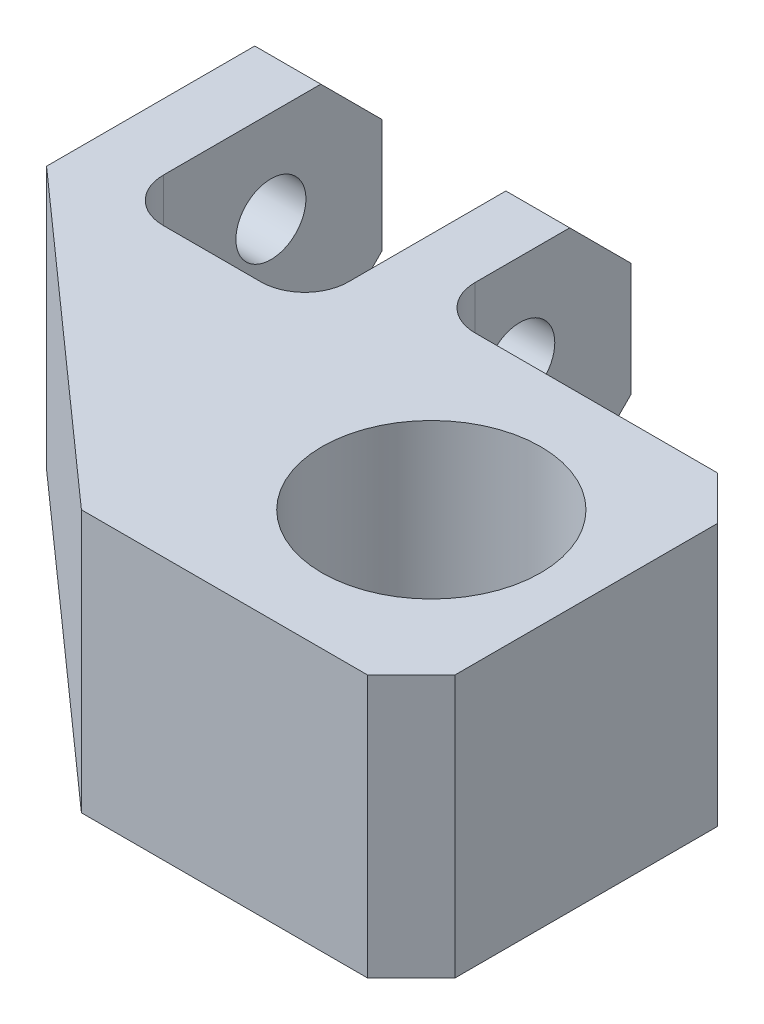
from build123d import *

# Parameters (mm, degrees)
SKETCH_1_W          = 37.703662968
SKETCH_1_H          = 40
SKETCH_1_R          = 12.5
EXTRUDE_1_DEPTH     = 30
EXTRUDE_3_DEPTH     = 30
SKETCH_9_W          = 21.151556031
SKETCH_9_H          = 33.5604842
CUT_EXTRUDE_5_DEPTH = 30
FILLET_4_R          = 5
CHAMFER_4_SIZE      = 7
FILLET_5_R          = 5
SKETCH_10_R         = 4.000000001
CUT_EXTRUDE_6_DEPTH = 91.362494631
CHAMFER_6_SIZE      = 10
CHAMFER_7_SIZE      = 5


with BuildPart() as part:
    # Эскиз1 → Вытянуть1 (new body)
    with BuildSketch(Plane(origin=(0, 0, 0), x_dir=(1, 0, 0), z_dir=(0, 1, 0))):
        with Locations((-1.148168516, 0)):
            Rectangle(SKETCH_1_W, SKETCH_1_H)
        with Locations(Location((0, 0, 0), (0, 0, 270))):
            Circle(SKETCH_1_R, mode=Mode.SUBTRACT)
    extrude(amount=EXTRUDE_1_DEPTH)

    # Эскиз8 → Вытянуть3 (add)
    with BuildSketch(Plane.XZ):
        Polygon((-20, 20), (-56, -12.013671604), (-56, -42.815306854), (-20, -42.815306854), align=None)
    extrude(amount=-EXTRUDE_3_DEPTH)

    # Эскиз9 → Вырез-Вытянуть5 (cut)
    with BuildSketch(Plane(origin=(0, 0, -42.815306854), x_dir=(-1, 0, 0), z_dir=(0, 0, -1))):
        with Locations((37.872859834, 13.650165161)):
            Rectangle(SKETCH_9_W, SKETCH_9_H)
    extrude(amount=-CUT_EXTRUDE_5_DEPTH, mode=Mode.SUBTRACT)

    # Скругление4
    fillet_4_edges = [part.edges().sort_by_distance(p)[0] for p in [
        (-27.297081818, 15, -12.815306854),
        (-48.448637849, 15, -12.815306854),
    ]]
    fillet(fillet_4_edges, radius=FILLET_4_R)

    # Фаска4
    chamfer_4_edges = [part.edges().sort_by_distance(p)[0] for p in [
        (-52.224318925, 30, -42.815306854),
        (-23.648540909, 30, -42.815306854),
    ]]
    chamfer(chamfer_4_edges, length=CHAMFER_4_SIZE)

    # Скругление5
    fillet_5_edges = [part.edges().sort_by_distance(p)[0] for p in [
        (-20, 15, -20),
    ]]
    fillet(fillet_5_edges, radius=FILLET_5_R)

    # Эскиз10 → Вырез-Вытянуть6 (cut, through all)
    with BuildSketch(Plane.ZY.offset(56)):
        with Locations((-30.109876722, 19.484541516)):
            Circle(SKETCH_10_R)
    extrude(amount=-CUT_EXTRUDE_6_DEPTH, mode=Mode.SUBTRACT)

    # Фаска6
    chamfer_6_edges = [part.edges().sort_by_distance(p)[0] for p in [
        (-23.648540909, 0, -42.815306854),
        (-52.224318925, 0, -42.815306854),
    ]]
    chamfer(chamfer_6_edges, length=CHAMFER_6_SIZE)

    # Фаска7
    chamfer_7_edges = [part.edges().sort_by_distance(p)[0] for p in [
        (17.703662968, 15, -20),
        (17.703662968, 15, 20),
    ]]
    chamfer(chamfer_7_edges, length=CHAMFER_7_SIZE)


solid = part.part
